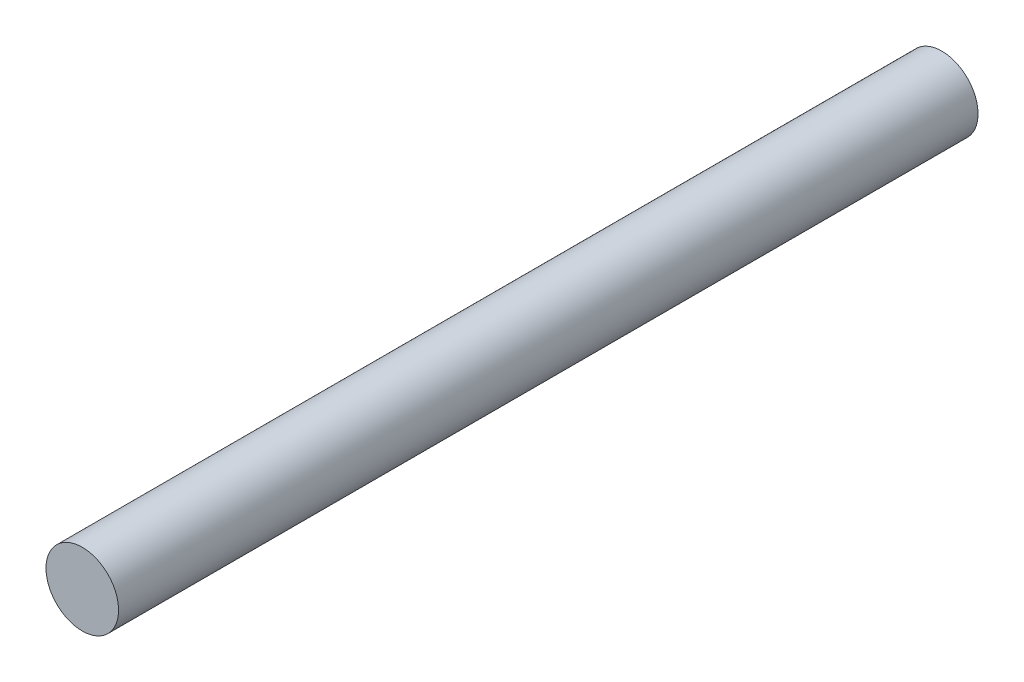
from build123d import *

# Parameters (mm, degrees)
SKETCH1_R           = 3.8
BOSS_EXTRUDE1_DEPTH = 90


with BuildPart() as part:
    # Sketch1 → Boss-Extrude1 (new body)
    with BuildSketch(Plane.XY):
        with Locations(Location((0, 0, 0), (0, 0, 180))):
            Circle(SKETCH1_R)
    extrude(amount=BOSS_EXTRUDE1_DEPTH)


solid = part.part
